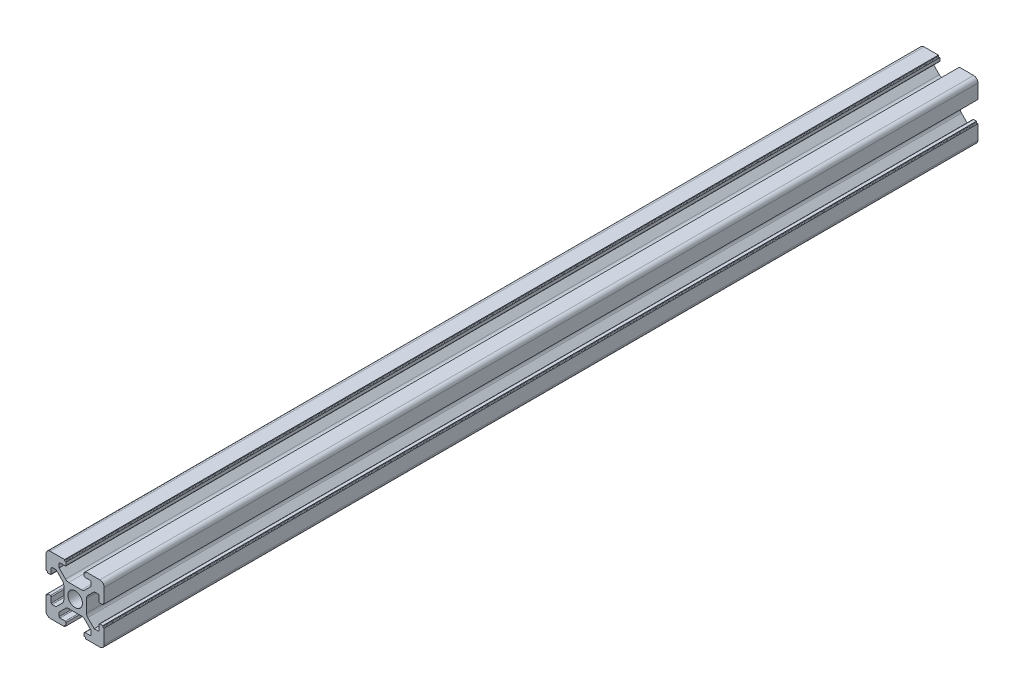
from build123d import *

# Parameters (mm, degrees)
SKETCH_1_R      = 2.5
EXTRUDE_1_DEPTH = 300


with BuildPart() as part:
    # 草图1 → 凸台-拉伸1 (new body)
    with BuildSketch(Plane.XY):
        with BuildLine():
            Line((4.215995631, 3.244230202), (6.436655803, 5.464890373))
            Line((6.436655803, 5.464890373), (7.776655803, 5.464890373))
            ThreePointArc((7.776655803, 5.464890373), (7.988787838, 5.377022408), (8.076655803, 5.164890373))
            Line((8.076655803, 5.164890373), (8.076655803, 3.364890373))
            ThreePointArc((8.076655803, 3.364890373), (8.164523769, 3.152758339), (8.376655803, 3.064890373))
            Line((8.376655803, 3.064890373), (9.376655803, 3.064890373))
            Line((9.376655803, 3.064890373), (9.376655803, 3.364890373))
            ThreePointArc((9.376655803, 3.364890373), (9.435234447, 3.50631173), (9.576655803, 3.564890373))
            Line((9.576655803, 3.564890373), (9.876655803, 3.564890373))
            Line((9.876655803, 3.564890373), (9.876655803, 8.464890373))
            ThreePointArc((9.876655803, 8.464890373), (9.437315975, 9.525550545), (8.376655803, 9.964890373))
            Line((8.376655803, 9.964890373), (3.476655803, 9.964890373))
            Line((3.476655803, 9.964890373), (3.476655803, 9.664890373))
            ThreePointArc((3.476655803, 9.664890373), (3.418077159, 9.523469017), (3.276655803, 9.464890373))
            Line((3.276655803, 9.464890373), (2.976655803, 9.464890373))
            Line((2.976655803, 9.464890373), (2.976655803, 8.464890373))
            ThreePointArc((2.976655803, 8.464890373), (3.064523769, 8.252758339), (3.276655803, 8.164890373))
            Line((3.276655803, 8.164890373), (5.076655803, 8.164890373))
            ThreePointArc((5.076655803, 8.164890373), (5.288787838, 8.077022408), (5.376655803, 7.864890373))
            Line((5.376655803, 7.864890373), (5.376655803, 6.524890373))
            Line((5.376655803, 6.524890373), (3.155995631, 4.304230202))
            ThreePointArc((3.155995631, 4.304230202), (2.669360608, 3.979071075), (2.09533546, 3.864890373))
            Line((2.09533546, 3.864890373), (-2.342023853, 3.864890373))
            ThreePointArc((-2.342023853, 3.864890373), (-2.916049002, 3.979071075), (-3.402684025, 4.304230202))
            Line((-3.402684025, 4.304230202), (-5.623344197, 6.524890373))
            Line((-5.623344197, 6.524890373), (-5.623344197, 7.864890373))
            ThreePointArc((-5.623344197, 7.864890373), (-5.535476231, 8.077022408), (-5.323344197, 8.164890373))
            Line((-5.323344197, 8.164890373), (-3.523344197, 8.164890373))
            ThreePointArc((-3.523344197, 8.164890373), (-3.311212162, 8.252758339), (-3.223344197, 8.464890373))
            Line((-3.223344197, 8.464890373), (-3.223344197, 9.464890373))
            Line((-3.223344197, 9.464890373), (-3.523344197, 9.464890373))
            ThreePointArc((-3.523344197, 9.464890373), (-3.664765553, 9.523469017), (-3.723344197, 9.664890373))
            Line((-3.723344197, 9.664890373), (-3.723344197, 9.964890373))
            Line((-3.723344197, 9.964890373), (-8.623344197, 9.964890373))
            ThreePointArc((-8.623344197, 9.964890373), (-9.684004369, 9.525550545), (-10.123344197, 8.464890373))
            Line((-10.123344197, 8.464890373), (-10.123344197, 3.564890373))
            Line((-10.123344197, 3.564890373), (-9.823344197, 3.564890373))
            ThreePointArc((-9.823344197, 3.564890373), (-9.681922841, 3.50631173), (-9.623344197, 3.364890373))
            Line((-9.623344197, 3.364890373), (-9.623344197, 3.064890373))
            Line((-9.623344197, 3.064890373), (-8.623344197, 3.064890373))
            ThreePointArc((-8.623344197, 3.064890373), (-8.411212162, 3.152758339), (-8.323344197, 3.364890373))
            Line((-8.323344197, 3.364890373), (-8.323344197, 5.164890373))
            ThreePointArc((-8.323344197, 5.164890373), (-8.235476231, 5.377022408), (-8.023344197, 5.464890373))
            Line((-8.023344197, 5.464890373), (-6.683344197, 5.464890373))
            Line((-6.683344197, 5.464890373), (-4.462684025, 3.244230202))
            ThreePointArc((-4.462684025, 3.244230202), (-4.137524898, 2.757595178), (-4.023344197, 2.18357003))
            Line((-4.023344197, 2.18357003), (-4.023344197, -2.253789283))
            ThreePointArc((-4.023344197, -2.253789283), (-4.137524898, -2.827814432), (-4.462684025, -3.314449455))
            Line((-4.462684025, -3.314449455), (-6.683344197, -5.535109627))
            Line((-6.683344197, -5.535109627), (-8.023344197, -5.535109627))
            ThreePointArc((-8.023344197, -5.535109627), (-8.235476231, -5.447241661), (-8.323344197, -5.235109627))
            Line((-8.323344197, -5.235109627), (-8.323344197, -3.435109627))
            ThreePointArc((-8.323344197, -3.435109627), (-8.411212162, -3.222977592), (-8.623344197, -3.135109627))
            Line((-8.623344197, -3.135109627), (-9.623344197, -3.135109627))
            Line((-9.623344197, -3.135109627), (-9.623344197, -3.435109627))
            ThreePointArc((-9.623344197, -3.435109627), (-9.681922841, -3.576530983), (-9.823344197, -3.635109627))
            Line((-9.823344197, -3.635109627), (-10.123344197, -3.635109627))
            Line((-10.123344197, -3.635109627), (-10.123344197, -8.535109627))
            ThreePointArc((-10.123344197, -8.535109627), (-9.684004369, -9.595769798), (-8.623344197, -10.035109627))
            Line((-8.623344197, -10.035109627), (-3.723344197, -10.035109627))
            Line((-3.723344197, -10.035109627), (-3.723344197, -9.735109627))
            ThreePointArc((-3.723344197, -9.735109627), (-3.664765553, -9.59368827), (-3.523344197, -9.535109627))
            Line((-3.523344197, -9.535109627), (-3.223344197, -9.535109627))
            Line((-3.223344197, -9.535109627), (-3.223344197, -8.535109627))
            ThreePointArc((-3.223344197, -8.535109627), (-3.311212162, -8.322977592), (-3.523344197, -8.235109627))
            Line((-3.523344197, -8.235109627), (-5.323344197, -8.235109627))
            ThreePointArc((-5.323344197, -8.235109627), (-5.535476231, -8.147241661), (-5.623344197, -7.935109627))
            Line((-5.623344197, -7.935109627), (-5.623344197, -6.595109627))
            Line((-5.623344197, -6.595109627), (-3.402684025, -4.374449455))
            ThreePointArc((-3.402684025, -4.374449455), (-2.916049002, -4.049290328), (-2.342023853, -3.935109627))
            Line((-2.342023853, -3.935109627), (2.09533546, -3.935109627))
            ThreePointArc((2.09533546, -3.935109627), (2.669360608, -4.049290328), (3.155995631, -4.374449455))
            Line((3.155995631, -4.374449455), (5.376655803, -6.595109627))
            Line((5.376655803, -6.595109627), (5.376655803, -7.935109627))
            ThreePointArc((5.376655803, -7.935109627), (5.288787838, -8.147241661), (5.076655803, -8.235109627))
            Line((5.076655803, -8.235109627), (3.276655803, -8.235109627))
            ThreePointArc((3.276655803, -8.235109627), (3.064523769, -8.322977592), (2.976655803, -8.535109627))
            Line((2.976655803, -8.535109627), (2.976655803, -9.535109627))
            Line((2.976655803, -9.535109627), (3.276655803, -9.535109627))
            ThreePointArc((3.276655803, -9.535109627), (3.418077159, -9.59368827), (3.476655803, -9.735109627))
            Line((3.476655803, -9.735109627), (3.476655803, -10.035109627))
            Line((3.476655803, -10.035109627), (8.376655803, -10.035109627))
            ThreePointArc((8.376655803, -10.035109627), (9.437315975, -9.595769798), (9.876655803, -8.535109627))
            Line((9.876655803, -8.535109627), (9.876655803, -3.635109627))
            Line((9.876655803, -3.635109627), (9.576655803, -3.635109627))
            ThreePointArc((9.576655803, -3.635109627), (9.435234447, -3.576530983), (9.376655803, -3.435109627))
            Line((9.376655803, -3.435109627), (9.376655803, -3.135109627))
            Line((9.376655803, -3.135109627), (8.376655803, -3.135109627))
            ThreePointArc((8.376655803, -3.135109627), (8.164523769, -3.222977592), (8.076655803, -3.435109627))
            Line((8.076655803, -3.435109627), (8.076655803, -5.235109627))
            ThreePointArc((8.076655803, -5.235109627), (7.988787838, -5.447241661), (7.776655803, -5.535109627))
            Line((7.776655803, -5.535109627), (6.436655803, -5.535109627))
            Line((6.436655803, -5.535109627), (4.215995631, -3.314449455))
            ThreePointArc((4.215995631, -3.314449455), (3.890836504, -2.827814432), (3.776655803, -2.253789283))
            Line((3.776655803, -2.253789283), (3.776655803, 2.18357003))
            ThreePointArc((3.776655803, 2.18357003), (3.890836504, 2.757595178), (4.215995631, 3.244230202))
        make_face()
        with Locations((-0.123344197, -0.035109627)):
            Circle(SKETCH_1_R, mode=Mode.SUBTRACT)
    extrude(amount=EXTRUDE_1_DEPTH)


solid = part.part
